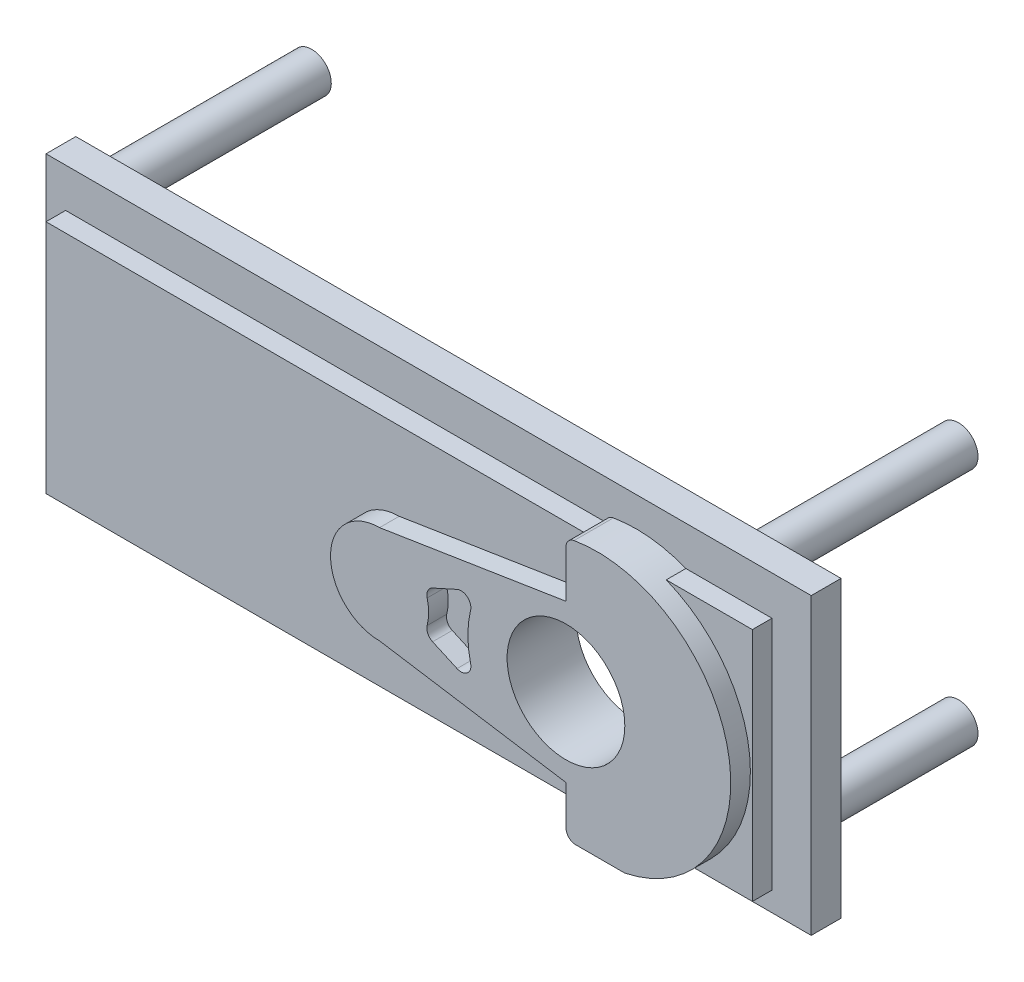
from build123d import *

# Parameters (mm, degrees)
SCHIZZO1_W                   = 39
SCHIZZO1_H                   = 15
ESTRUSIONE_ESTRUSIONE1_DEPTH = 2.52
SCHIZZO2_W                   = 39
SCHIZZO2_H                   = 15
SCHIZZO2_W_2                 = 36
SCHIZZO2_H_2                 = 12
TAGLIO_ESTRUSIONE1_DEPTH     = 1
TAGLIO_ESTRUSIONE2_REACH     = 23.044
SCHIZZO3_R                   = 3
ESTRUSIONE_ESTRUSIONE2_START = 1
SCHIZZO4_R                   = 3
ESTRUSIONE_ESTRUSIONE2_DEPTH = 2
SCHIZZO5_W                   = 37
SCHIZZO5_H                   = 13
TAGLIO_ESTRUSIONE4_DEPTH     = 1
TAGLIO_ESTRUSIONE9_DEPTH     = 1.5
ESTRUSIONE_ESTRUSIONE3_START = -1
SCHIZZO11_R                  = 1
ESTRUSIONE_ESTRUSIONE3_DEPTH = 11
SCHIZZO12_R                  = 1
TAGLIO_ESTRUSIONE10_DEPTH    = 1.5
SCHIZZO13_R                  = 4.25
SCHIZZO13_R_2                = 3
ESTRUSIONE_ESTRUSIONE4_DEPTH = 1


with BuildPart() as part:
    # Schizzo1 → Estrusione-Estrusione1 (new body)
    with BuildSketch(Plane.XY):
        Rectangle(SCHIZZO1_W, SCHIZZO1_H)
    extrude(amount=ESTRUSIONE_ESTRUSIONE1_DEPTH)

    # Schizzo2 → Taglio-Estrusione1 (cut)
    with BuildSketch(Plane.XY.offset(2.52)):
        Rectangle(SCHIZZO2_W, SCHIZZO2_H)
        with Locations((-0.5, -0.5)):
            Rectangle(SCHIZZO2_W_2, SCHIZZO2_H_2, mode=Mode.SUBTRACT)
    extrude(amount=-TAGLIO_ESTRUSIONE1_DEPTH, mode=Mode.SUBTRACT)

    # Schizzo3 → Taglio-Estrusione2 (cut, up to next)
    with BuildSketch(Plane.XY.offset(2.52), mode=Mode.PRIVATE) as taglio_estrusione2_sk1:
        with Locations((9, -1)):
            Circle(SCHIZZO3_R)
    taglio_estrusione2_tool1 = extrude(taglio_estrusione2_sk1.sketch, amount=-TAGLIO_ESTRUSIONE2_REACH, mode=Mode.PRIVATE) & part.part
    add(taglio_estrusione2_tool1.solids().sort_by_distance((9, -1, 2.52))[0], mode=Mode.SUBTRACT)

    # Schizzo4 → Estrusione-Estrusione2 (add)
    with BuildSketch(Plane.XY.offset(2.52).offset(ESTRUSIONE_ESTRUSIONE2_START)):
        with BuildLine():
            Line((-0.5, 1.5), (9, 3))
            Line((9, 3), (9, 5.392769143))
            ThreePointArc((9, 5.392769143), (9.117356016, 5.714613176), (9.414334326, 5.885375875))
            ThreePointArc((9.414334326, 5.885375875), (17.276253266, 0.461644492), (12, -7.5))
            Line((12, -7.5), (9.5, -7.5))
            ThreePointArc((9.5, -7.5), (9.146446609, -7.353553391), (9, -7))
            Line((9, -7), (9, -5))
            Line((9, -5), (-0.5, -3.5))
            ThreePointArc((-0.5, -3.5), (-3, -1), (-0.5, 1.5))
        make_face()
        with Locations((9, -1)):
            Circle(SCHIZZO4_R, mode=Mode.SUBTRACT)
        with BuildLine():
            Line((3.448203243, 0.746895178), (2.204268804, 0.186161276))
            ThreePointArc((2.204268804, 0.186161276), (1.959671645, -0.051873187), (1.924787234, -0.391389392))
            ThreePointArc((1.924787234, -0.391389392), (2, -1), (1.924787234, -1.608610608))
            ThreePointArc((1.924787234, -1.608610608), (1.959671645, -1.948126813), (2.204268804, -2.186161276))
            Line((2.204268804, -2.186161276), (3.448203243, -2.746895178))
            ThreePointArc((3.448203243, -2.746895178), (3.972766245, -2.67601261), (4.139708291, -2.173696937))
            ThreePointArc((4.139708291, -2.173696937), (4, -1), (4.139708291, 0.173696937))
            ThreePointArc((4.139708291, 0.173696937), (3.972766245, 0.67601261), (3.448203243, 0.746895178))
        make_face(mode=Mode.SUBTRACT)
    extrude(amount=-ESTRUSIONE_ESTRUSIONE2_DEPTH)

    # Schizzo5 → Taglio-Estrusione4 (cut)
    with BuildSketch(Plane(origin=(0, 0, 0), x_dir=(-1, 0, 0), z_dir=(0, 0, -1))):
        Rectangle(SCHIZZO5_W, SCHIZZO5_H)
    extrude(amount=-TAGLIO_ESTRUSIONE4_DEPTH, mode=Mode.SUBTRACT)

    # Schizzo6 → Taglio-Estrusione9 (cut)
    with BuildSketch(Plane(origin=(0, 0, 0), x_dir=(-1, 0, 0), z_dir=(0, 0, -1))):
        with BuildLine():
            Line((-9, 4.916079783), (-9, 4.153882032))
            ThreePointArc((-9, 4.153882032), (-9.22848325, 3.517673022), (-9.80952381, 3.172190216))
            ThreePointArc((-9.80952381, 3.172190216), (-13.25, -1), (-9.80952381, -5.172190216))
            ThreePointArc((-9.80952381, -5.172190216), (-9.22848325, -5.517673022), (-9, -6.153882032))
            Line((-9, -6.153882032), (-9, -6.916079783))
            ThreePointArc((-9, -6.916079783), (-9.354502776, -7.679842399), (-10.166666667, -7.90209308))
            ThreePointArc((-10.166666667, -7.90209308), (-16, -1), (-10.166666667, 5.90209308))
            ThreePointArc((-10.166666667, 5.90209308), (-9.354502776, 5.679842399), (-9, 4.916079783))
        make_face()
    extrude(amount=-TAGLIO_ESTRUSIONE9_DEPTH, mode=Mode.SUBTRACT)

    # Schizzo11 → Estrusione-Estrusione3 (add)
    with BuildSketch(Plane(origin=(0, 0, 0), x_dir=(-1, 0, 0), z_dir=(0, 0, -1)).offset(ESTRUSIONE_ESTRUSIONE3_START)):
        with Locations(Location((-15.48, -5.864394435, 0), (0, 0, 219.464912598))):
            Circle(SCHIZZO11_R)
        with Locations(Location((-15.48, 6.364394435, 0), (0, 0, 172.206361755))):
            Circle(SCHIZZO11_R)
        with Locations(Location((17.48, 6.364394435, 0), (0, 0, 7.793638245))):
            Circle(SCHIZZO11_R)
        with Locations(Location((17.48, -5.864394435, 0), (0, 0, 219.464912598))):
            Circle(SCHIZZO11_R)
    extrude(amount=ESTRUSIONE_ESTRUSIONE3_DEPTH)

    # Schizzo12 → Taglio-Estrusione10 (cut)
    with BuildSketch(Plane(origin=(0, 0, 1), x_dir=(-1, 0, 0), z_dir=(0, 0, -1))):
        with Locations((-0.2, -2)):
            Circle(SCHIZZO12_R)
    extrude(amount=-TAGLIO_ESTRUSIONE10_DEPTH, mode=Mode.SUBTRACT)

    # Schizzo13 → Estrusione-Estrusione4 (add)
    with BuildSketch(Plane(origin=(0, 0, 1), x_dir=(-1, 0, 0), z_dir=(0, 0, -1))):
        with Locations(Location((-9, -1, 0), (0, 0, 90))):
            Circle(SCHIZZO13_R)
        with Locations(Location((-9, -1, 0), (0, 0, 180))):
            Circle(SCHIZZO13_R_2, mode=Mode.SUBTRACT)
    extrude(amount=ESTRUSIONE_ESTRUSIONE4_DEPTH)


solid = part.part
